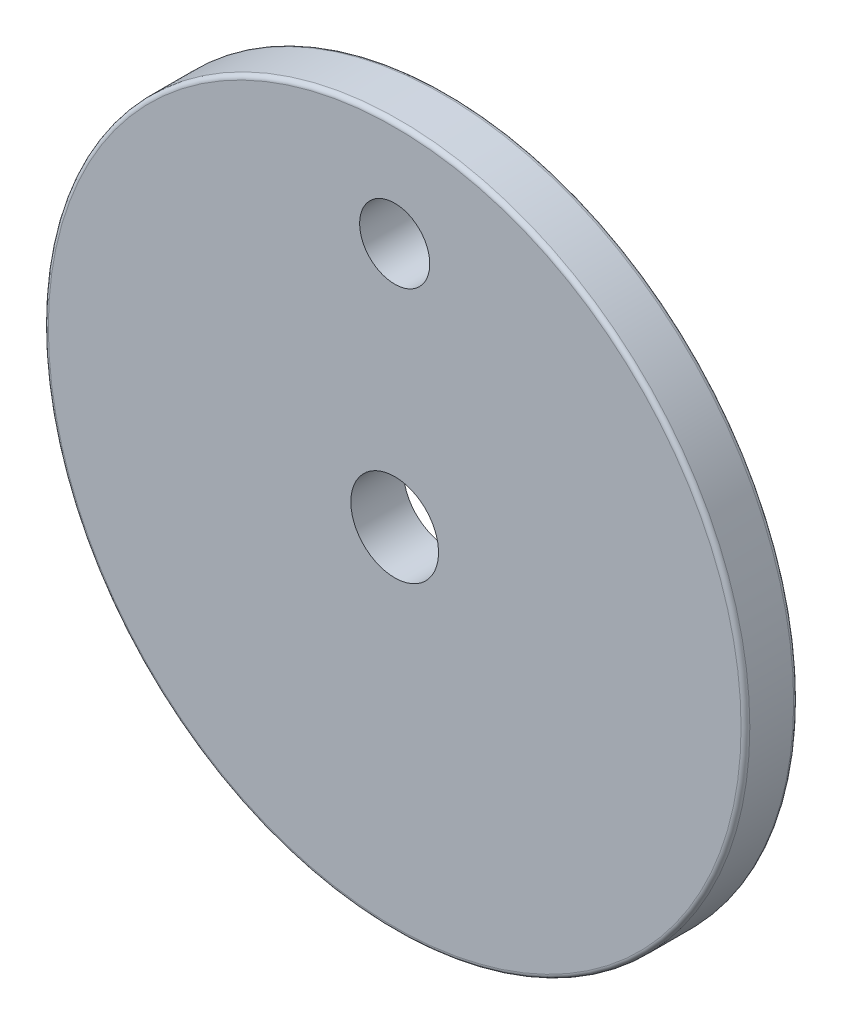
from build123d import *

# Parameters (mm, degrees)
SKETCH1_R           = 508
SKETCH1_R_2         = 63.5
SKETCH1_R_3         = 50.8
BOSS_EXTRUDE1_DEPTH = 38.1
FILLET1_R           = 6.35


with BuildPart() as part:
    # Sketch1 → Boss-Extrude1 (new, symmetric)
    with BuildSketch(Plane.XY):
        with Locations(Location((0, 0, 0), (0, 0, 180))):
            Circle(SKETCH1_R)
        with Locations(Location((0, 0, 0), (0, 0, 180))):
            Circle(SKETCH1_R_2, mode=Mode.SUBTRACT)
        with Locations(Location((0, 355.6, 0), (0, 0, 180))):
            Circle(SKETCH1_R_3, mode=Mode.SUBTRACT)
    extrude(amount=BOSS_EXTRUDE1_DEPTH, both=True)

    # Fillet1
    fillet1_edges = [part.edges().sort_by_distance(p)[0] for p in [
        (508, 0, -38.1),
        (508, 0, 38.1),
    ]]
    fillet(fillet1_edges, radius=FILLET1_R)


solid = part.part
